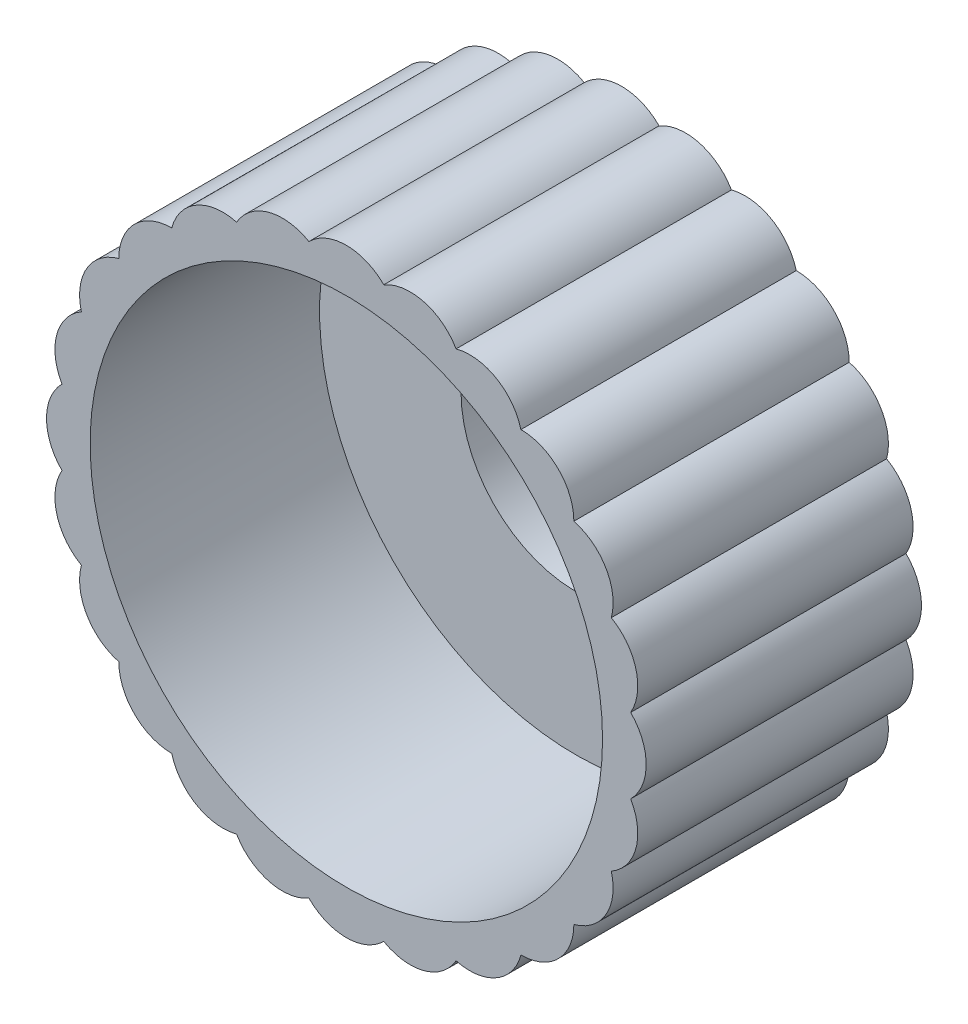
from build123d import *
from build123d.topology import SkipClean

# Parameters (mm, degrees)
SKETCH1_R           = 18.75
SKETCH1_R_2         = 16.75
BOSS_EXTRUDE1_DEPTH = 15
BOSS_EXTRUDE2_START = 3
SKETCH3_R           = 18.75
SKETCH3_R_2         = 7.5
BOSS_EXTRUDE2_DEPTH = 3
BOSS_EXTRUDE3_DEPTH = 18
CIRPATTERN1_COUNT   = 24


with BuildPart() as part:
    # Sketch1 → Boss-Extrude1 (new body)
    with BuildSketch(Plane.XY):
        Circle(SKETCH1_R)
        Circle(SKETCH1_R_2, mode=Mode.SUBTRACT)
    extrude(amount=BOSS_EXTRUDE1_DEPTH)

    # Sketch3 → Boss-Extrude2 (add)
    with BuildSketch(Plane(origin=(0, 0, 0), x_dir=(-1, 0, 0), z_dir=(0, 0, -1)).offset(BOSS_EXTRUDE2_START)):
        Circle(SKETCH3_R)
        Circle(SKETCH3_R_2, mode=Mode.SUBTRACT)
    extrude(amount=-BOSS_EXTRUDE2_DEPTH)

    # Sketch4 → Boss-Extrude3 (add)
    with SkipClean():  # the faces are left unmerged after this step: merging them gives an invalid solid
        with BuildSketch(Plane(origin=(0, 0, -3), x_dir=(-1, 0, 0), z_dir=(0, 0, -1))):
            with BuildLine():
                ThreePointArc((-2.447366104, 18.589591151), (0, 19.603323383), (2.447366104, 18.589591151))
                ThreePointArc((2.447366104, 18.589591151), (0, 18.75), (-2.447366104, 18.589591151))
            make_face()
        boss_extrude3 = extrude(amount=-BOSS_EXTRUDE3_DEPTH)

    # CirPattern1: Boss-Extrude3 ×24 about axis
    with SkipClean():  # the faces are left unmerged after this step: merging them gives an invalid solid
        cirpattern1_axis = Axis((0, 0, 0), (0, 0, 1))
        for i in range(1, CIRPATTERN1_COUNT):
            add(boss_extrude3.rotate(cirpattern1_axis, i * 360 / CIRPATTERN1_COUNT))


solid = part.part
